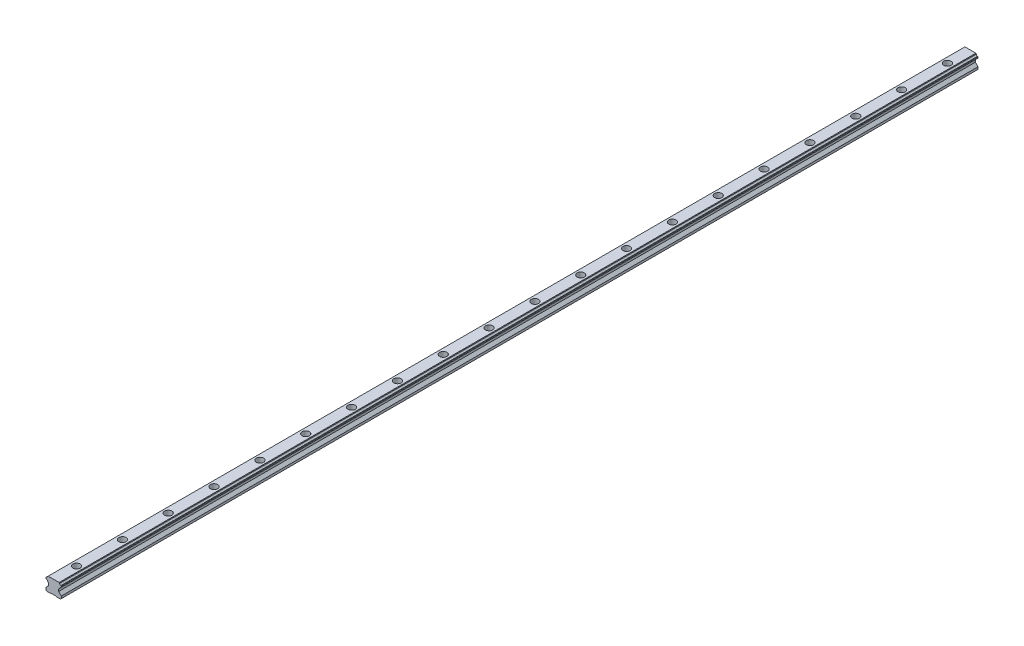
from build123d import *

# Parameters (mm, degrees)
BOSS_EXTRUDE1_DEPTH = 600
LPATTERN1_COUNT     = 20
LPATTERN1_PITCH     = 60


with BuildPart() as part:
    # Sketch1 → Boss-Extrude1 (new, symmetric)
    with BuildSketch(Plane.XY):
        with BuildLine():
            Line((-10, -10.494534492), (-10, -13.49461174))
            Line((-10, -13.49461174), (-9, -14.49461174))
            Line((-9, -14.49461174), (-3, -14.49461174))
            Line((-3, -14.49461174), (-2.5, -13.99461174))
            Line((-2.5, -13.99461174), (2.5, -13.99461174))
            Line((2.5, -13.99461174), (3, -14.49461174))
            Line((3, -14.49461174), (9, -14.49461174))
            Line((9, -14.49461174), (10, -13.49461174))
            Line((10, -13.49461174), (10, -10.494534492))
            Line((10, -10.494534492), (6.550048828, -7.044660568))
            Line((6.550048828, -7.044660568), (6.550048828, -4.115376472))
            Line((6.550048828, -4.115376472), (7.767930373, -2.899480236))
            ThreePointArc((7.767930373, -2.899480236), (8.341068744, -1.762979997), (9.472673258, -1.180235103))
            Line((9.472673258, -1.180235103), (10, -0.665425301))
            Line((10, -0.665425301), (10, 0.665425301))
            Line((10, 0.665425301), (9.472673258, 1.192752043))
            ThreePointArc((9.472673258, 1.192752043), (8.344874488, 1.769695527), (7.767930373, 2.897493974))
            Line((7.767930373, 2.897493974), (7.160036564, 3.50538826))
            Line((7.160036564, 3.50538826), (-7.160036564, 3.50538826))
            Line((-7.160036564, 3.50538826), (-7.767930373, 2.897493974))
            ThreePointArc((-7.767930373, 2.897493974), (-8.344874488, 1.769695527), (-9.472673258, 1.192752043))
            Line((-9.472673258, 1.192752043), (-10, 0.665425301))
            Line((-10, 0.665425301), (-10, -0.665425301))
            Line((-10, -0.665425301), (-9.472673258, -1.180235103))
            ThreePointArc((-9.472673258, -1.180235103), (-8.341068744, -1.762979997), (-7.767930373, -2.899480236))
            Line((-7.767930373, -2.899480236), (-6.550048828, -4.115376472))
            Line((-6.550048828, -4.115376472), (-6.550048828, -7.044660568))
            Line((-6.550048828, -7.044660568), (-10, -10.494534492))
        make_face()
    extrude(amount=BOSS_EXTRUDE1_DEPTH, both=True)

    # Sketch2 → Cut-Revolve1 (revolve, cut)
    with BuildSketch(Plane(origin=(0, 0, 0), x_dir=(0, 0, -1), z_dir=(1, 0, 0))):
        Polygon((-570, 3.50538826), (-570, -14.49461174), (-573, -14.49461174), (-573, -4.99461174), (-574.75, -4.99461174), (-574.75, 3.50538826), align=None)
    cut_revolve1 = revolve(axis=Axis((0, 3.50538826, 570), (0, -1, 0)), mode=Mode.SUBTRACT)

    # LPattern1: Cut-Revolve1 ×20
    with Locations(*[(0, 0, -i * LPATTERN1_PITCH) for i in range(1, LPATTERN1_COUNT)]):
        add(cut_revolve1, mode=Mode.SUBTRACT)


solid = part.part
